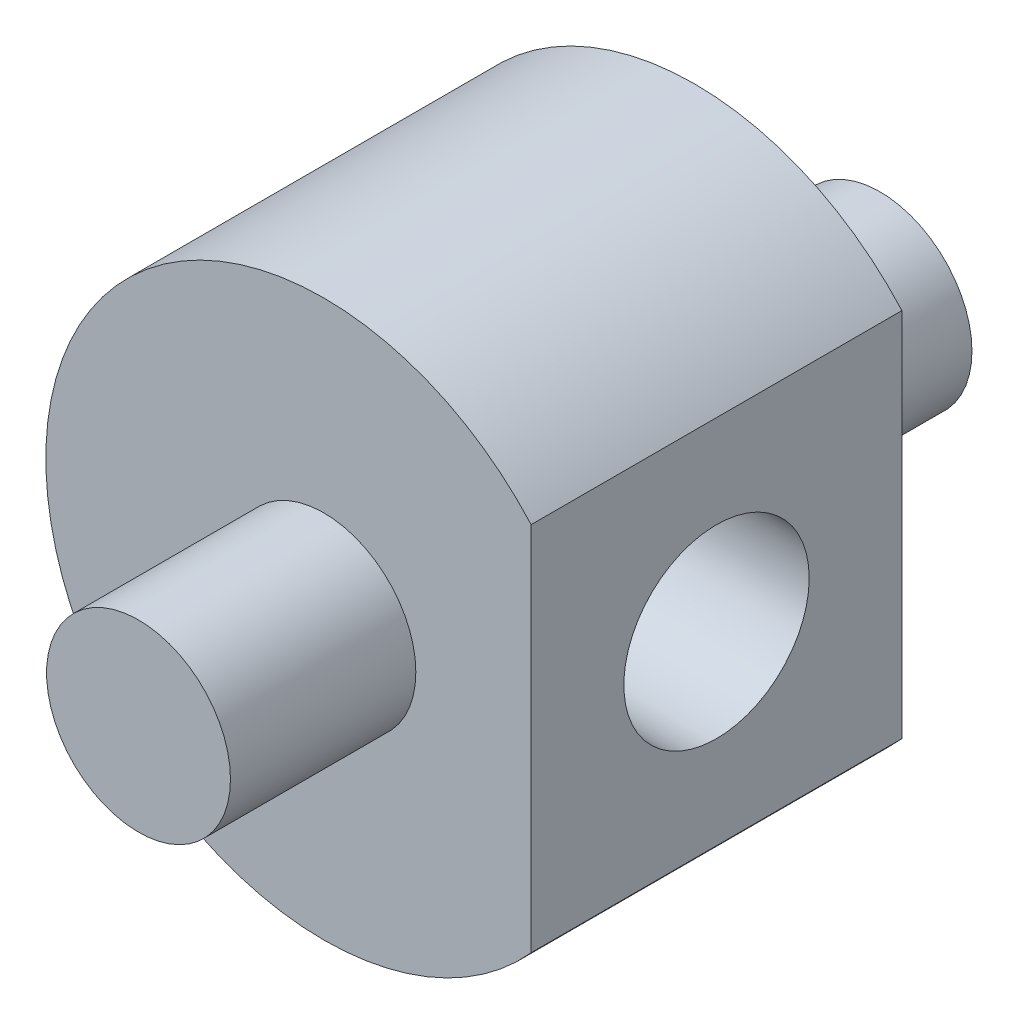
from build123d import *

# Parameters (mm, degrees)
BOSS_EXTRUDE1_DEPTH      = 12.7
BOSS_EXTRUDE2_DEPTH      = 6.35
BOSS_EXTRUDE2_DEPTH_BACK = 19.05
SKETCH3_R                = 3.1496
SKETCH4_R                = 3.175
CUT_EXTRUDE1_DEPTH       = 30.854524808


with BuildPart() as part:
    # Sketch1 → Boss-Extrude1 (new body)
    with BuildSketch(Plane.XY):
        with BuildLine():
            Line((0, 0), (0, 12.7))
            ThreePointArc((0, 12.7), (-16.624515829, 6.35), (0, 0))
        make_face()
    extrude(amount=BOSS_EXTRUDE1_DEPTH)

    # Sketch3 → Boss-Extrude2 (add, two sides: drawn at the far end of the back side and taken through both)
    with BuildSketch(Plane.XY.offset(12.7).offset(-BOSS_EXTRUDE2_DEPTH_BACK)):
        with Locations((-7.099515829, 6.35)):
            Circle(SKETCH3_R)
    extrude(amount=BOSS_EXTRUDE2_DEPTH + BOSS_EXTRUDE2_DEPTH_BACK)

    # Sketch4 → Cut-Extrude1 (cut, through all)
    with BuildSketch(Plane(origin=(0, 0, 0), x_dir=(0, 0, -1), z_dir=(1, 0, 0))):
        with Locations((-6.35, 6.35)):
            Circle(SKETCH4_R)
    extrude(amount=-CUT_EXTRUDE1_DEPTH, mode=Mode.SUBTRACT)


solid = part.part
